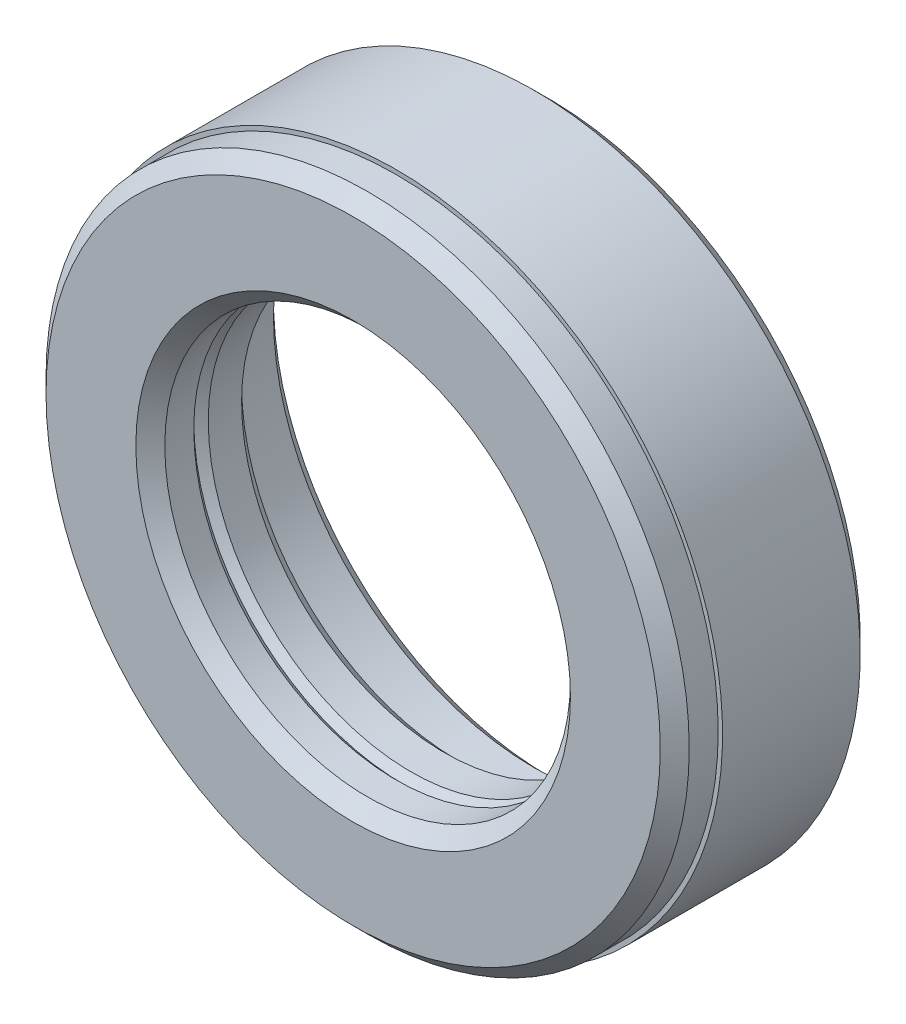
from build123d import *

# Parameters (mm, degrees)
CHAMFER1_SIZE = 1


with BuildPart() as part:
    # Sketch1 → Revolve1 (revolve)
    with BuildSketch(Plane(origin=(0, 0, 0), x_dir=(0, 0, -1), z_dir=(1, 0, 0)), mode=Mode.PRIVATE) as revolve1_sk:
        Polygon((0, 0), (-13.5, 0), (-13.5, 21.2), (-12.5, 22.2), (-10.5, 22.2), (-10.5, 22.5), (-1, 22.5), (0, 21.5), align=None)
    revolve(revolve1_sk.sketch.rotate(Axis((0, 0, 0), (0, 0, 1)), 90), axis=Axis((0, 0, 0), (0, 0, 1)))

    # Sketch2 → Cut-Revolve1 (revolve, cut)
    with BuildSketch(Plane(origin=(0, 0, 0), x_dir=(0, 0, -1), z_dir=(1, 0, 0)), mode=Mode.PRIVATE) as cut_revolve1_sk:
        Polygon((0, 0), (-13.5, 0), (-13.5, 14), (-10.5, 14), (-10, 14.5), (-9.5, 14), (-7.2, 14), (-6.2, 15), (-6.2, 18), (0, 18), align=None)
    revolve(cut_revolve1_sk.sketch.rotate(Axis((0, 0, 0), (0, 0, 1)), 90), axis=Axis((0, 0, 0), (0, 0, 1)), mode=Mode.SUBTRACT)

    # Chamfer1
    chamfer1_edges = [part.edges().sort_by_distance(p)[0] for p in [
        (18, 0, 0),
        (14, 0, 13.5),
    ]]
    chamfer(chamfer1_edges, length=CHAMFER1_SIZE)


solid = part.part
